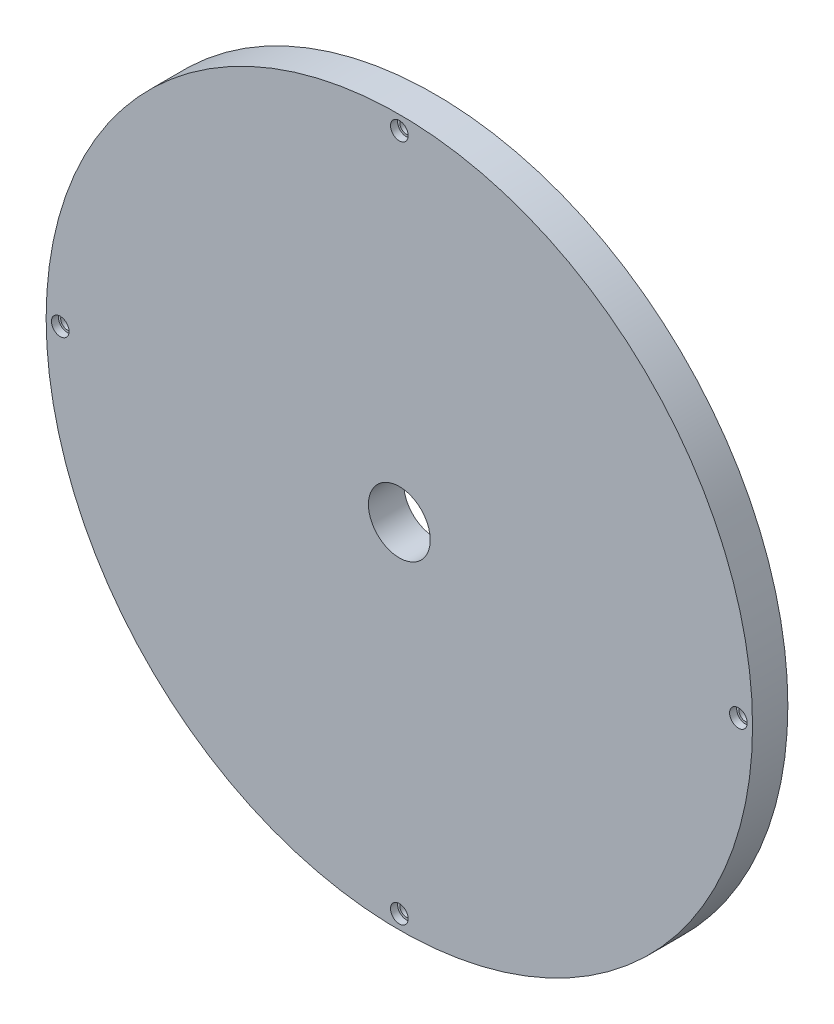
from build123d import *

# Parameters (mm, degrees)
SKETCH1_R           = 63.5
BOSS_EXTRUDE1_DEPTH = 6.35
SKETCH2_R           = 57.15
SKETCH2_R_2         = 50.8
CUT_EXTRUDE1_DEPTH  = 1.27
SKETCH4_R           = 1.190625
CUT_EXTRUDE2_DEPTH  = 91.02678768
SKETCH5_R           = 1.5875
CUT_EXTRUDE3_DEPTH  = 1.27
SKETCH6_R           = 5.55625
CUT_EXTRUDE4_DEPTH  = 91.02678768


with BuildPart() as part:
    # Sketch1 → Boss-Extrude1 (new body)
    with BuildSketch(Plane.XY):
        Circle(SKETCH1_R)
    extrude(amount=BOSS_EXTRUDE1_DEPTH)

    # Sketch2 → Cut-Extrude1 (cut)
    with BuildSketch(Plane(origin=(0, 0, 0), x_dir=(-1, 0, 0), z_dir=(0, 0, -1))):
        Circle(SKETCH2_R)
        Circle(SKETCH2_R_2, mode=Mode.SUBTRACT)
    extrude(amount=-CUT_EXTRUDE1_DEPTH, mode=Mode.SUBTRACT)

    # Sketch4 → Cut-Extrude2 (cut, through all)
    with BuildSketch(Plane(origin=(0, 0, 0), x_dir=(-1, 0, 0), z_dir=(0, 0, -1))):
        with Locations((0, 60.96)):
            Circle(SKETCH4_R)
        with Locations((60.96, 0)):
            Circle(SKETCH4_R)
        with Locations((0, -60.96)):
            Circle(SKETCH4_R)
        with Locations((-60.96, 0)):
            Circle(SKETCH4_R)
    extrude(amount=-CUT_EXTRUDE2_DEPTH, mode=Mode.SUBTRACT)

    # Sketch5 → Cut-Extrude3 (cut)
    with BuildSketch(Plane.XY.offset(6.35)):
        with Locations((0, 60.96)):
            Circle(SKETCH5_R)
        with Locations((60.96, 0)):
            Circle(SKETCH5_R)
        with Locations((0, -60.96)):
            Circle(SKETCH5_R)
        with Locations((-60.96, 0)):
            Circle(SKETCH5_R)
    extrude(amount=-CUT_EXTRUDE3_DEPTH, mode=Mode.SUBTRACT)

    # Sketch6 → Cut-Extrude4 (cut, through all)
    with BuildSketch(Plane(origin=(0, 0, 0), x_dir=(-1, 0, 0), z_dir=(0, 0, -1))):
        Circle(SKETCH6_R)
    extrude(amount=-CUT_EXTRUDE4_DEPTH, mode=Mode.SUBTRACT)


solid = part.part
